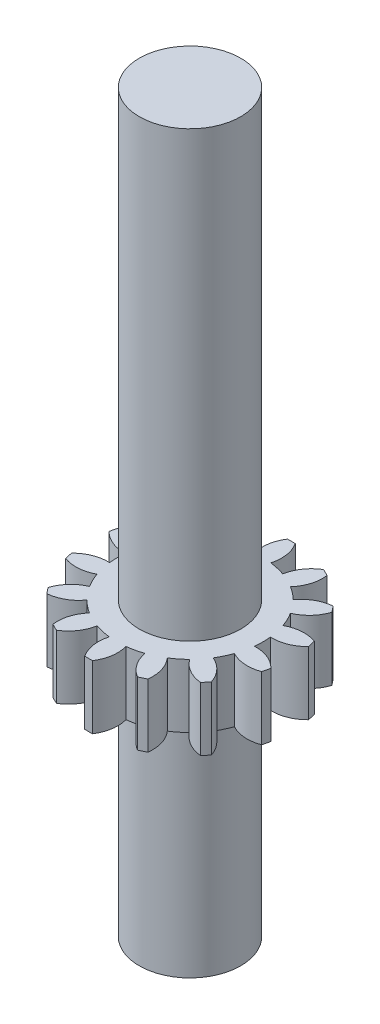
from build123d import *

# Parameters (mm, degrees)
SKETCH1_R                = 0.4
BOSS_EXTRUDE1_DEPTH      = 5
BOSS_EXTRUDE2_DEPTH      = 18
BOSS_EXTRUDE2_DEPTH_BACK = 5
SKETCH2_R                = 4
BOSS_EXTRUDE3_START      = 35
SKETCH3_R                = 4
BOSS_EXTRUDE3_DEPTH      = 35
CUT_EXTRUDE1_DEPTH       = 18


with BuildPart() as part:
    # Sketch1 → Boss-Extrude1 (new body)
    with BuildSketch(Plane(origin=(0, 0, 0), x_dir=(1, 0, 0), z_dir=(0, 1, 0))):
        with BuildLine():
            ThreePointArc((3.744900382, -7.069350828), (3.64692573, -5.891768521), (3.071904032, -4.859465672))
            ThreePointArc((3.071904032, -4.859465672), (3.584442871, -4.494749193), (4.054065768, -4.076217824))
            ThreePointArc((4.054065768, -4.076217824), (4.932532263, -4.866531521), (6.058788713, -5.224086459))
            ThreePointArc((6.058788713, -5.224086459), (6.25465186, -4.987918415), (6.441315028, -4.744413632))
            ThreePointArc((6.441315028, -4.744413632), (5.842109102, -3.725958242), (4.876133034, -3.045378078))
            ThreePointArc((4.876133034, -3.045378078), (5.179670022, -2.494397616), (5.421191676, -1.913552144))
            ThreePointArc((5.421191676, -1.913552144), (6.555566902, -2.244447854), (7.725426174, -2.077929362))
            ThreePointArc((7.725426174, -2.077929362), (7.799423297, -1.780167472), (7.861948235, -1.47978713))
            ThreePointArc((7.861948235, -1.47978713), (6.880191117, -0.822176238), (5.714584087, -0.628116006))
            ThreePointArc((5.714584087, -0.628116006), (5.749, 0), (5.714584087, 0.628116006))
            ThreePointArc((5.714584087, 0.628116006), (6.880191117, 0.822176238), (7.861948235, 1.47978713))
            ThreePointArc((7.861948235, 1.47978713), (7.799423297, 1.780167472), (7.725426174, 2.077929362))
            ThreePointArc((7.725426174, 2.077929362), (6.555566902, 2.244447854), (5.421191676, 1.913552144))
            ThreePointArc((5.421191676, 1.913552144), (5.179670022, 2.494397616), (4.876133034, 3.045378078))
            ThreePointArc((4.876133034, 3.045378078), (5.842109102, 3.725958242), (6.441315028, 4.744413632))
            ThreePointArc((6.441315028, 4.744413632), (6.25465186, 4.987918415), (6.058788713, 5.224086459))
            ThreePointArc((6.058788713, 5.224086459), (4.932532263, 4.866531521), (4.054065768, 4.076217824))
            ThreePointArc((4.054065768, 4.076217824), (3.584442871, 4.494749193), (3.071904032, 4.859465672))
            ThreePointArc((3.071904032, 4.859465672), (3.64692573, 5.891768521), (3.744900382, 7.069350828))
            ThreePointArc((3.744900382, 7.069350828), (3.471069913, 7.207750943), (3.192133841, 7.335549164))
            ThreePointArc((3.192133841, 7.335549164), (2.332549116, 6.524738937), (1.883982415, 5.431538572))
            ThreePointArc((1.883982415, 5.431538572), (1.279272849, 5.604860567), (0.659246762, 5.711076493))
            ThreePointArc((0.659246762, 5.711076493), (0.72942399, 6.890641786), (0.306762287, 7.994116393))
            ThreePointArc((0.306762287, 7.994116393), (0, 8), (-0.306762287, 7.994116393))
            ThreePointArc((-0.306762287, 7.994116393), (-0.72942399, 6.890641786), (-0.659246762, 5.711076493))
            ThreePointArc((-0.659246762, 5.711076493), (-1.279272849, 5.604860567), (-1.883982415, 5.431538572))
            ThreePointArc((-1.883982415, 5.431538572), (-2.332549116, 6.524738937), (-3.192133841, 7.335549164))
            ThreePointArc((-3.192133841, 7.335549164), (-3.471069913, 7.207750943), (-3.744900382, 7.069350828))
            ThreePointArc((-3.744900382, 7.069350828), (-3.64692573, 5.891768521), (-3.071904032, 4.859465672))
            ThreePointArc((-3.071904032, 4.859465672), (-3.584442871, 4.494749193), (-4.054065768, 4.076217824))
            ThreePointArc((-4.054065768, 4.076217824), (-4.932532263, 4.866531521), (-6.058788713, 5.224086459))
            ThreePointArc((-6.058788713, 5.224086459), (-6.25465186, 4.987918415), (-6.441315028, 4.744413632))
            ThreePointArc((-6.441315028, 4.744413632), (-5.842109102, 3.725958242), (-4.876133034, 3.045378078))
            ThreePointArc((-4.876133034, 3.045378078), (-5.179670022, 2.494397616), (-5.421191676, 1.913552144))
            ThreePointArc((-5.421191676, 1.913552144), (-6.555566902, 2.244447854), (-7.725426174, 2.077929362))
            ThreePointArc((-7.725426174, 2.077929362), (-7.799423297, 1.780167472), (-7.861948235, 1.47978713))
            ThreePointArc((-7.861948235, 1.47978713), (-6.880191117, 0.822176238), (-5.714584087, 0.628116006))
            ThreePointArc((-5.714584087, 0.628116006), (-5.749, 0), (-5.714584087, -0.628116006))
            ThreePointArc((-5.714584087, -0.628116006), (-6.880191117, -0.822176238), (-7.861948235, -1.47978713))
            ThreePointArc((-7.861948235, -1.47978713), (-7.799423297, -1.780167472), (-7.725426174, -2.077929362))
            ThreePointArc((-7.725426174, -2.077929362), (-6.555566902, -2.244447854), (-5.421191676, -1.913552144))
            ThreePointArc((-5.421191676, -1.913552144), (-5.179670022, -2.494397616), (-4.876133034, -3.045378078))
            ThreePointArc((-4.876133034, -3.045378078), (-5.842109102, -3.725958242), (-6.441315028, -4.744413632))
            ThreePointArc((-6.441315028, -4.744413632), (-6.25465186, -4.987918415), (-6.058788713, -5.224086459))
            ThreePointArc((-6.058788713, -5.224086459), (-4.932532263, -4.866531521), (-4.054065768, -4.076217824))
            ThreePointArc((-4.054065768, -4.076217824), (-3.584442871, -4.494749193), (-3.071904032, -4.859465672))
            ThreePointArc((-3.071904032, -4.859465672), (-3.64692573, -5.891768521), (-3.744900382, -7.069350828))
            ThreePointArc((-3.744900382, -7.069350828), (-3.471069913, -7.207750943), (-3.192133841, -7.335549164))
            ThreePointArc((-3.192133841, -7.335549164), (-2.332549116, -6.524738937), (-1.883982415, -5.431538572))
            ThreePointArc((-1.883982415, -5.431538572), (-1.279272849, -5.604860567), (-0.659246762, -5.711076493))
            ThreePointArc((-0.659246762, -5.711076493), (-0.72942399, -6.890641786), (-0.306762287, -7.994116393))
            ThreePointArc((-0.306762287, -7.994116393), (0, -8), (0.306762287, -7.994116393))
            ThreePointArc((0.306762287, -7.994116393), (0.72942399, -6.890641786), (0.659246762, -5.711076493))
            ThreePointArc((0.659246762, -5.711076493), (1.279272849, -5.604860567), (1.883982415, -5.431538572))
            ThreePointArc((1.883982415, -5.431538572), (2.332549116, -6.524738937), (3.192133841, -7.335549164))
            ThreePointArc((3.192133841, -7.335549164), (3.471069913, -7.207750943), (3.744900382, -7.069350828))
        make_face()
        with Locations(Location((0, 0, 0), (0, 0, 90))):
            Circle(SKETCH1_R, mode=Mode.SUBTRACT)
    extrude(amount=-BOSS_EXTRUDE1_DEPTH)

    # Sketch2 → Boss-Extrude2 (add, two sides: drawn at the far end of the back side and taken through both)
    with BuildSketch(Plane.XZ.offset(5).offset(-BOSS_EXTRUDE2_DEPTH_BACK)):
        with Locations(Location((0, 0, 0), (0, 0, 270))):
            Circle(SKETCH2_R)
    extrude(amount=BOSS_EXTRUDE2_DEPTH + BOSS_EXTRUDE2_DEPTH_BACK)

    # Sketch3 → Boss-Extrude3 (add)
    with BuildSketch(Plane(origin=(0, 0, 0), x_dir=(1, 0, 0), z_dir=(0, 1, 0)).offset(BOSS_EXTRUDE3_START)):
        with Locations(Location((0, 0, 0), (0, 0, 90))):
            Circle(SKETCH3_R)
    extrude(amount=-BOSS_EXTRUDE3_DEPTH)

    # Sketch4 → Cut-Extrude1 (cut)
    with BuildSketch(Plane.XZ.offset(23)):
        with BuildLine():
            Line((-2, -1.5), (2, -1.5))
            ThreePointArc((2, -1.5), (2.5, 0), (2, 1.5))
            Line((2, 1.5), (-2, 1.5))
            ThreePointArc((-2, 1.5), (-2.5, 0), (-2, -1.5))
        make_face()
    extrude(amount=-CUT_EXTRUDE1_DEPTH, mode=Mode.SUBTRACT)


solid = part.part
